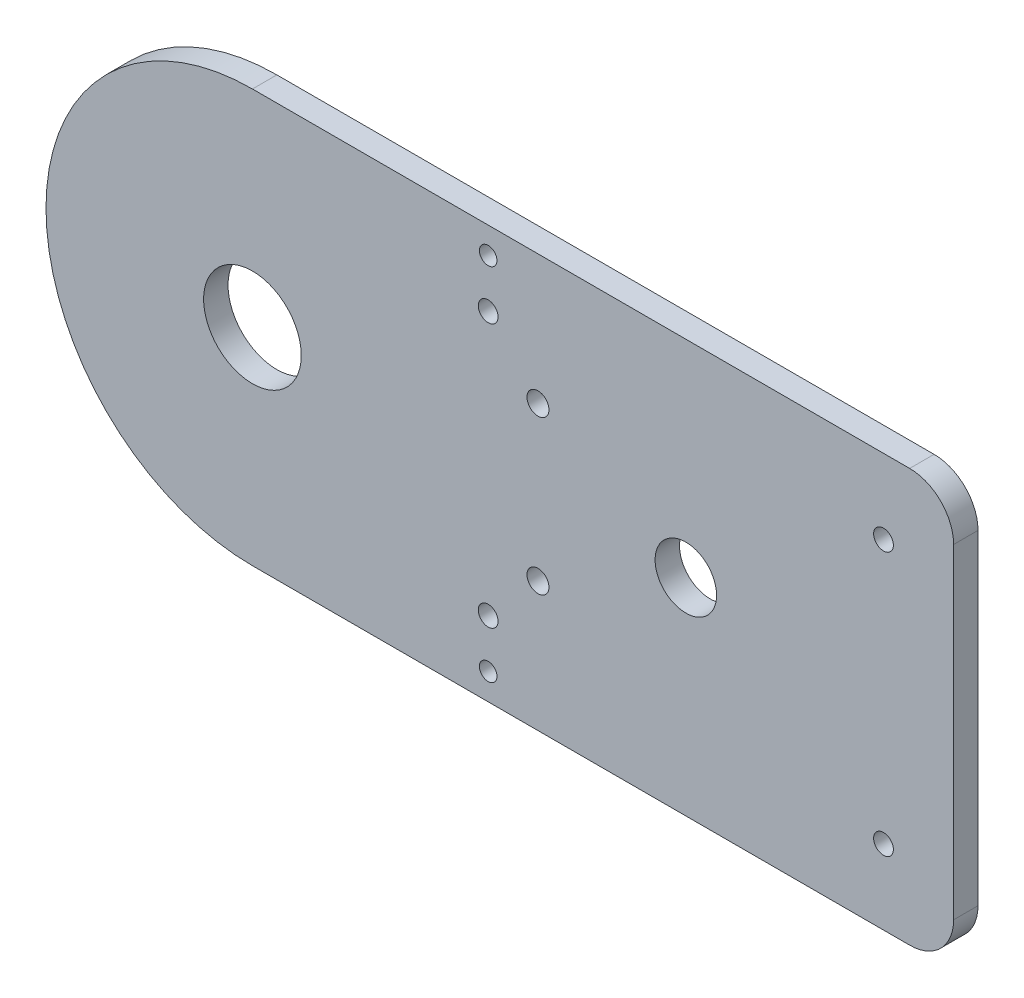
from build123d import *

# Parameters (mm, degrees)
SKETCH1_R           = 11.1125
BOSS_EXTRUDE1_DEPTH = 5.55625
SKETCH2_R           = 7
CUT_EXTRUDE1_DEPTH  = 5.55625
FILLET1_R           = 10
SKETCH3_R           = 2.25
SKETCH3_R_2         = 2
CUT_EXTRUDE2_DEPTH  = 6.35
SKETCH4_R           = 2.5
CUT_EXTRUDE3_DEPTH  = 40


with BuildPart() as part:
    # Sketch1 → Boss-Extrude1 (new body)
    with BuildSketch(Plane.XY):
        with BuildLine():
            Line((-65, 47), (94.62424518, 47))
            Line((94.62424518, 47), (94.62424518, -47))
            Line((94.62424518, -47), (-65, -47))
            ThreePointArc((-65, -47), (-112, 0), (-65, 47))
        make_face()
        with Locations((-65, 0)):
            Circle(SKETCH1_R, mode=Mode.SUBTRACT)
    extrude(amount=BOSS_EXTRUDE1_DEPTH)

    # Sketch2 → Cut-Extrude1 (cut)
    with BuildSketch(Plane.XY.offset(5.55625)):
        with Locations((33.666397681, 0)):
            Circle(SKETCH2_R)
    extrude(amount=-CUT_EXTRUDE1_DEPTH, mode=Mode.SUBTRACT)

    # Fillet1
    fillet1_edges = [part.edges().sort_by_distance(p)[0] for p in [
        (94.62424518, 47, 2.778125),
        (94.62424518, -47, 2.778125),
    ]]
    fillet(fillet1_edges, radius=FILLET1_R)

    # Sketch3 → Cut-Extrude2 (cut)
    with BuildSketch(Plane.XY.offset(5.55625)):
        with Locations((78.666397681, 30)):
            Circle(SKETCH3_R)
        with Locations((78.666397681, -30)):
            Circle(SKETCH3_R)
        with Locations((-11.333602319, 30)):
            Circle(SKETCH3_R)
        with Locations((-11.333602319, -30)):
            Circle(SKETCH3_R)
        with Locations((-11.333602319, 41)):
            Circle(SKETCH3_R_2)
        with Locations((-11.333602319, -41)):
            Circle(SKETCH3_R_2)
    extrude(amount=-CUT_EXTRUDE2_DEPTH, mode=Mode.SUBTRACT)

    # Sketch4 → Cut-Extrude3 (cut)
    with BuildSketch(Plane.XY.offset(5.55625)):
        with Locations((0, 17.5)):
            Circle(SKETCH4_R)
        with Locations((0, -17.5)):
            Circle(SKETCH4_R)
    extrude(amount=-CUT_EXTRUDE3_DEPTH, mode=Mode.SUBTRACT)


solid = part.part
